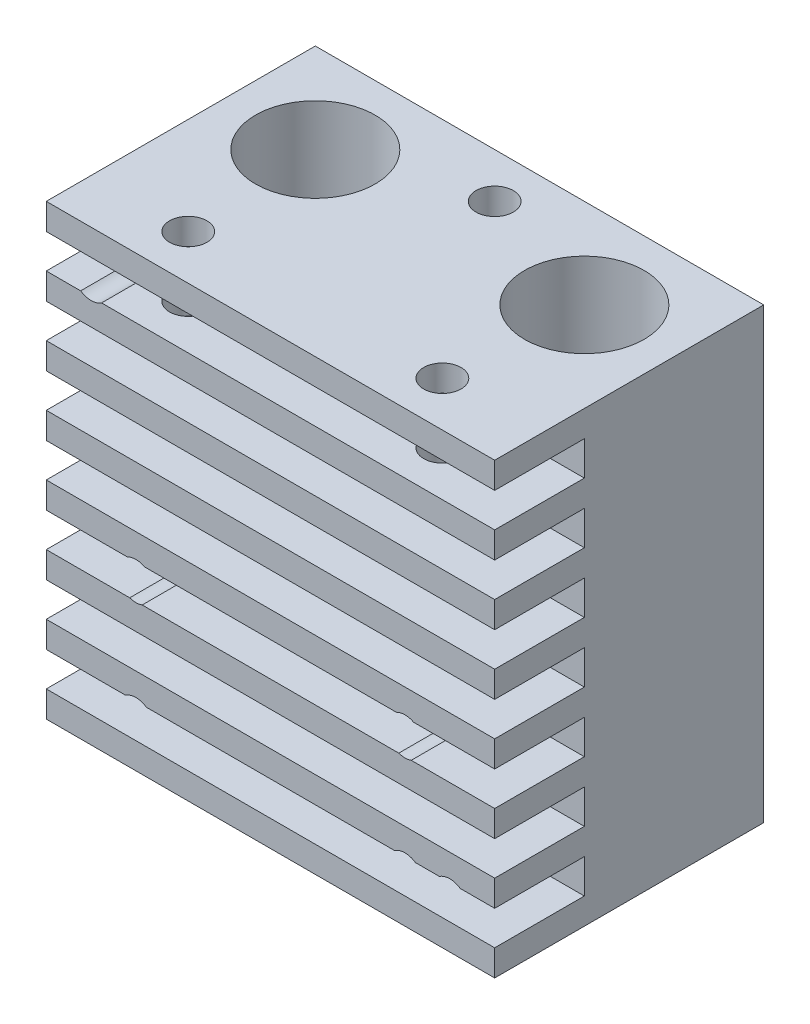
from build123d import *

# Parameters (mm, degrees)
BOSS_EXTRUDE1_DEPTH             = 15
TAP_DRILL_FOR_M3X0_5_TAP2_D     = 2.5
TAP_DRILL_FOR_M3X0_5_TAP2_DEPTH = 5
TAP_DRILL_FOR_M3X0_5_TAP2_TIP   = 0.751075774
F_7_0_7_DIAMETER_HOLE1_D        = 7
F_7_0_7_DIAMETER_HOLE1_DEPTH    = 14
F_7_0_7_DIAMETER_HOLE1_TIP      = 2.103012167
F_8_0_8_DIAMETER_HOLE1_D        = 8
F_8_0_8_DIAMETER_HOLE1_DEPTH    = 6.5
F_8_0_8_DIAMETER_HOLE1_TIP      = 2.403442476
F_4_2_4_2_DIAMETER_HOLE1_D      = 4.2
M3X0_5_TAPPED_HOLE1_D           = 2.5
M3X0_5_TAPPED_HOLE2_D           = 2.5
M3X0_5_TAPPED_HOLE2_DEPTH       = 6
M3X0_5_TAPPED_HOLE2_TIP         = 0.751075774
M3X0_5_TAPPED_HOLE3_D           = 2.5
M3X0_5_TAPPED_HOLE3_DEPTH       = 8
M3X0_5_TAPPED_HOLE3_TIP         = 0.751075774


with BuildPart() as part:
    # Sketch1 → Boss-Extrude1 (new, symmetric)
    with BuildSketch(Plane(origin=(0, 0, 0), x_dir=(0, 0, -1), z_dir=(1, 0, 0))):
        Polygon((-9, 15), (-9, 13.25), (-3, 13.25), (-3, 10.964285714), (-9, 10.964285714), (-9, 9.214285714), (-3, 9.214285714), (-3, 6.928571429), (-9, 6.928571429), (-9, 5.178571429), (-3, 5.178571429), (-3, 2.892857143), (-9, 2.892857143), (-9, 1.142857143), (-3, 1.142857143), (-3, -1.142857143), (-9, -1.142857143), (-9, -2.892857143), (-3, -2.892857143), (-3, -5.178571429), (-9, -5.178571429), (-9, -6.928571429), (-3, -6.928571429), (-3, -9.214285714), (-9, -9.214285714), (-9, -10.964285714), (-3, -10.964285714), (-3, -13.25), (-9, -13.25), (-9, -15), (9, -15), (9, 15), align=None)
    extrude(amount=BOSS_EXTRUDE1_DEPTH, both=True)

    # Tap Drill for M3x0.5 Tap2
    with Locations(Plane.XY.offset(9)):
        with Locations((-12, 12), (12, -12)):
            Hole(TAP_DRILL_FOR_M3X0_5_TAP2_D / 2, depth=TAP_DRILL_FOR_M3X0_5_TAP2_DEPTH)
            with Locations((0, 0, -(TAP_DRILL_FOR_M3X0_5_TAP2_DEPTH + TAP_DRILL_FOR_M3X0_5_TAP2_TIP / 2))):  # 118° drill point
                Cone(0, TAP_DRILL_FOR_M3X0_5_TAP2_D / 2, TAP_DRILL_FOR_M3X0_5_TAP2_TIP, mode=Mode.SUBTRACT)

    # Ø7.0 (7) Diameter Hole1
    with Locations(Plane(origin=(0, -15, 0), x_dir=(-1, 0, 0), z_dir=(0, -1, 0))):
        with Locations((9, 3), (-9, 3)):
            Hole(F_7_0_7_DIAMETER_HOLE1_D / 2, depth=F_7_0_7_DIAMETER_HOLE1_DEPTH)
            with Locations((0, 0, -(F_7_0_7_DIAMETER_HOLE1_DEPTH + F_7_0_7_DIAMETER_HOLE1_TIP / 2))):  # 118° drill point
                Cone(0, F_7_0_7_DIAMETER_HOLE1_D / 2, F_7_0_7_DIAMETER_HOLE1_TIP, mode=Mode.SUBTRACT)

    # Ø8.0 (8) Diameter Hole1
    with Locations(Plane(origin=(0, 15, 0), x_dir=(1, 0, 0), z_dir=(0, 1, 0))):
        with Locations((-9, 3), (9, 3)):
            Hole(F_8_0_8_DIAMETER_HOLE1_D / 2, depth=F_8_0_8_DIAMETER_HOLE1_DEPTH)
            with Locations((0, 0, -(F_8_0_8_DIAMETER_HOLE1_DEPTH + F_8_0_8_DIAMETER_HOLE1_TIP / 2))):  # 118° drill point
                Cone(0, F_8_0_8_DIAMETER_HOLE1_D / 2, F_8_0_8_DIAMETER_HOLE1_TIP, mode=Mode.SUBTRACT)

    # Ø4.2 (4.2) Diameter Hole1 (through all)
    with Locations(Plane(origin=(0, 15, 0), x_dir=(1, 0, 0), z_dir=(0, 1, 0))):
        with Locations((-9, 3), (9, 3)):
            Hole(F_4_2_4_2_DIAMETER_HOLE1_D / 2)

    # M3x0.5 Tapped Hole1 (through all)
    with Locations(Plane(origin=(0, 0, -9), x_dir=(-1, 0, 0), z_dir=(0, 0, -1))):
        with Locations((-9, -12), (-9, -4), (9, -4), (9, -12)):
            Hole(M3X0_5_TAPPED_HOLE1_D / 2)

    # M3x0.5 Tapped Hole2
    with Locations(Plane(origin=(0, 15, 0), x_dir=(1, 0, 0), z_dir=(0, 1, 0))):
        with Locations((-8.5, -6), (8.5, -6), (0, 6)):
            Hole(M3X0_5_TAPPED_HOLE2_D / 2, depth=M3X0_5_TAPPED_HOLE2_DEPTH)
            with Locations((0, 0, -(M3X0_5_TAPPED_HOLE2_DEPTH + M3X0_5_TAPPED_HOLE2_TIP / 2))):  # 118° drill point
                Cone(0, M3X0_5_TAPPED_HOLE2_D / 2, M3X0_5_TAPPED_HOLE2_TIP, mode=Mode.SUBTRACT)

    # M3x0.5 Tapped Hole3
    with Locations(Plane(origin=(0, 0, -9), x_dir=(-1, 0, 0), z_dir=(0, 0, -1))):
        with Locations((-4.5, 5), (4.5, 5), (0, -5)):
            Hole(M3X0_5_TAPPED_HOLE3_D / 2, depth=M3X0_5_TAPPED_HOLE3_DEPTH)
            with Locations((0, 0, -(M3X0_5_TAPPED_HOLE3_DEPTH + M3X0_5_TAPPED_HOLE3_TIP / 2))):  # 118° drill point
                Cone(0, M3X0_5_TAPPED_HOLE3_D / 2, M3X0_5_TAPPED_HOLE3_TIP, mode=Mode.SUBTRACT)


solid = part.part
